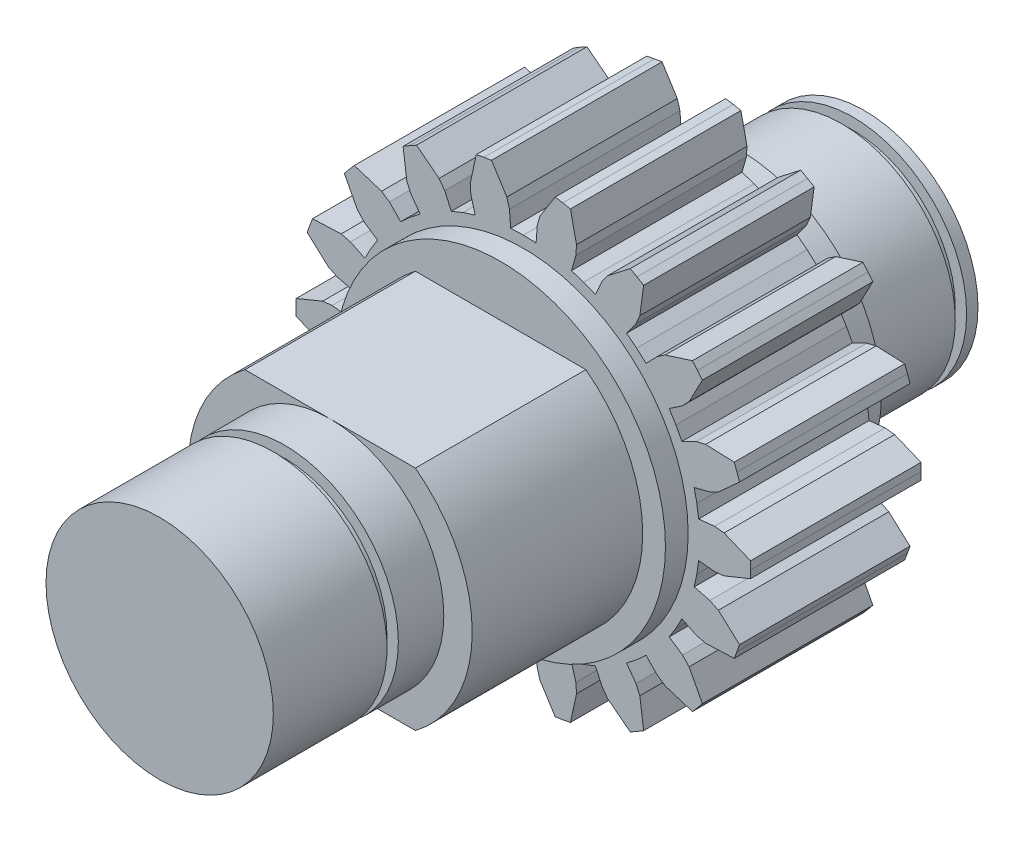
from build123d import *

# Parameters (mm, degrees)
GEAR_C_18T_INVOLUTE_DEPTH     = 15
SKETCH2_R                     = 12.5
LEFT_COLLAR_D25X4_DEPTH       = 4
SKETCH3_R                     = 10
LEFT_SHAFT_D20X15_DEPTH       = 15
SKETCH4_R                     = 14.5
RIGHT_SHOULDER_D29X2_DEPTH    = 2
RIGHT_GEARB_SEAT_D25X15_START = 15
SKETCH5_R                     = 12.5
RIGHT_GEARB_SEAT_D25X15_DEPTH = 15
RIGHT_STUB_D20X15_START       = 15
SKETCH6_R                     = 10
RIGHT_STUB_D20X15_DEPTH       = 15
SKETCH7_W                     = 28
SKETCH7_H                     = 4
DOUBLE_FLAT_CUT_20MM_DEPTH    = 15
SKETCH8_W                     = 1
SKETCH8_H                     = 2
SKETCH9_W                     = 1
SKETCH9_H                     = 2


with BuildPart() as part:
    # Sketch1 → Gear_C_18T_Involute (new body)
    with BuildSketch(Plane.XY):
        Polygon((15.419169018, -1.580894305), (16.826259884, -1.725160312), (17.660768385, -1.634521308), (19.988384487, -0.681531814), (20, 0), (19.988384487, 0.681531814), (17.660768385, 1.634521308), (16.826259884, 1.725160312), (15.419169018, 1.580894305), (15.264520172, 2.691546754), (15.029977041, 3.788111684), (16.401551826, 4.133799402), (17.154732941, 4.504390922), (19.016035012, 6.19599971), (18.793852416, 6.840402867), (18.549839795, 7.476860544), (16.036654516, 7.576286146), (15.221472671, 7.376040232), (13.948581648, 6.75922111), (13.423393759, 7.75), (12.827948015, 8.700215498), (13.998574556, 9.4941619), (14.579583527, 10.10000713), (15.750071069, 12.326202226), (15.320888862, 12.855752194), (14.873910657, 13.370369545), (12.478283437, 12.604239061), (11.780751209, 12.137260841), (10.795589472, 11.122286094), (9.96320795, 11.873688868), (9.078679138, 12.562944922), (9.907162598, 13.709388354), (10.245921168, 14.477413417), (10.584416108, 16.969682839), (10, 17.320508076), (9.403968379, 17.651214653), (7.414847216, 16.111934726), (6.919097286, 15.434548666), (6.34048988, 14.143839227), (5.301312222, 14.565235622), (4.23438757, 14.910397778), (4.620800616, 16.271060244), (4.676449503, 17.108629983), (4.142124355, 19.566369255), (3.472963553, 19.69615506), (2.799768726, 19.80306277), (1.457070989, 17.676293276), (1.222898115, 16.870202132), (1.120633632, 15.459436609), (0, 15.5), (-1.120633632, 15.459436609), (-1.222898115, 16.870202132), (-1.457070989, 17.676293276), (-2.799768726, 19.80306277), (-3.472963553, 19.69615506), (-4.142124355, 19.566369255), (-4.676449503, 17.108629983), (-4.620800616, 16.271060244), (-4.23438757, 14.910397778), (-5.301312222, 14.565235622), (-6.34048988, 14.143839227), (-6.919097286, 15.434548666), (-7.414847216, 16.111934726), (-9.403968379, 17.651214653), (-10, 17.320508076), (-10.584416108, 16.969682839), (-10.245921168, 14.477413417), (-9.907162598, 13.709388354), (-9.078679138, 12.562944922), (-9.96320795, 11.873688868), (-10.795589472, 11.122286094), (-11.780751209, 12.137260841), (-12.478283437, 12.604239061), (-14.873910657, 13.370369545), (-15.320888862, 12.855752194), (-15.750071069, 12.326202226), (-14.579583527, 10.10000713), (-13.998574556, 9.4941619), (-12.827948015, 8.700215498), (-13.423393759, 7.75), (-13.948581648, 6.75922111), (-15.221472671, 7.376040232), (-16.036654516, 7.576286146), (-18.549839795, 7.476860544), (-18.793852416, 6.840402867), (-19.016035012, 6.19599971), (-17.154732941, 4.504390922), (-16.401551826, 4.133799402), (-15.029977041, 3.788111684), (-15.264520172, 2.691546754), (-15.419169018, 1.580894305), (-16.826259884, 1.725160312), (-17.660768385, 1.634521308), (-19.988384487, 0.681531814), (-20, 0), (-19.988384487, -0.681531814), (-17.660768385, -1.634521308), (-16.826259884, -1.725160312), (-15.419169018, -1.580894305), (-15.264520172, -2.691546754), (-15.029977041, -3.788111684), (-16.401551826, -4.133799402), (-17.154732941, -4.504390922), (-19.016035012, -6.19599971), (-18.793852416, -6.840402867), (-18.549839795, -7.476860544), (-16.036654516, -7.576286146), (-15.221472671, -7.376040232), (-13.948581648, -6.75922111), (-13.423393759, -7.75), (-12.827948015, -8.700215498), (-13.998574556, -9.4941619), (-14.579583527, -10.10000713), (-15.750071069, -12.326202226), (-15.320888862, -12.855752194), (-14.873910657, -13.370369545), (-12.478283437, -12.604239061), (-11.780751209, -12.137260841), (-10.795589472, -11.122286094), (-9.96320795, -11.873688868), (-9.078679138, -12.562944922), (-9.907162598, -13.709388354), (-10.245921168, -14.477413417), (-10.584416108, -16.969682839), (-10, -17.320508076), (-9.403968379, -17.651214653), (-7.414847216, -16.111934726), (-6.919097286, -15.434548666), (-6.34048988, -14.143839227), (-5.301312222, -14.565235622), (-4.23438757, -14.910397778), (-4.620800616, -16.271060244), (-4.676449503, -17.108629983), (-4.142124355, -19.566369255), (-3.472963553, -19.69615506), (-2.799768726, -19.80306277), (-1.457070989, -17.676293276), (-1.222898115, -16.870202132), (-1.120633632, -15.459436609), (0, -15.5), (1.120633632, -15.459436609), (1.222898115, -16.870202132), (1.457070989, -17.676293276), (2.799768726, -19.80306277), (3.472963553, -19.69615506), (4.142124355, -19.566369255), (4.676449503, -17.108629983), (4.620800616, -16.271060244), (4.23438757, -14.910397778), (5.301312222, -14.565235622), (6.34048988, -14.143839227), (6.919097286, -15.434548666), (7.414847216, -16.111934726), (9.403968379, -17.651214653), (10, -17.320508076), (10.584416108, -16.969682839), (10.245921168, -14.477413417), (9.907162598, -13.709388354), (9.078679138, -12.562944922), (9.96320795, -11.873688868), (10.795589472, -11.122286094), (11.780751209, -12.137260841), (12.478283437, -12.604239061), (14.873910657, -13.370369545), (15.320888862, -12.855752194), (15.750071069, -12.326202226), (14.579583527, -10.10000713), (13.998574556, -9.4941619), (12.827948015, -8.700215498), (13.423393759, -7.75), (13.948581648, -6.75922111), (15.221472671, -7.376040232), (16.036654516, -7.576286146), (18.549839795, -7.476860544), (18.793852416, -6.840402867), (19.016035012, -6.19599971), (17.154732941, -4.504390922), (16.401551826, -4.133799402), (15.029977041, -3.788111684), (15.264520172, -2.691546754), align=None)
    extrude(amount=GEAR_C_18T_INVOLUTE_DEPTH)

    # Sketch2 → Left_Collar_D25x4 (add)
    with BuildSketch(Plane.XY):
        Circle(SKETCH2_R)
    extrude(amount=-LEFT_COLLAR_D25X4_DEPTH)

    # Sketch3 → Left_Shaft_D20x15 (add)
    with BuildSketch(Plane.XY):
        Circle(SKETCH3_R)
    extrude(amount=-LEFT_SHAFT_D20X15_DEPTH)

    # Sketch4 → Right_Shoulder_D29x2 (add)
    with BuildSketch(Plane.XY.offset(15)):
        Circle(SKETCH4_R)
    extrude(amount=RIGHT_SHOULDER_D29X2_DEPTH)

    # Sketch5 → Right_GearB_Seat_D25x15 (add)
    with BuildSketch(Plane.XY.offset(17).offset(RIGHT_GEARB_SEAT_D25X15_START)):
        Circle(SKETCH5_R)
    extrude(amount=-RIGHT_GEARB_SEAT_D25X15_DEPTH)

    # Sketch6 → Right_Stub_D20x15 (add)
    with BuildSketch(Plane.XY.offset(32).offset(RIGHT_STUB_D20X15_START)):
        Circle(SKETCH6_R)
    extrude(amount=-RIGHT_STUB_D20X15_DEPTH)

    # Sketch7 → Double_Flat_Cut_20mm (cut)
    with BuildSketch(Plane.XY.offset(17)):
        with Locations((0, 12)):
            Rectangle(SKETCH7_W, SKETCH7_H)
        with Locations((0, -12)):
            Rectangle(SKETCH7_W, SKETCH7_H)
    extrude(amount=DOUBLE_FLAT_CUT_20MM_DEPTH, mode=Mode.SUBTRACT)

    # Sketch8 → Left_SnapRing_Groove_D18 (revolve, cut)
    with BuildSketch(Plane(origin=(0, 0, 0), x_dir=(0, 0, -1), z_dir=(1, 0, 0)), mode=Mode.PRIVATE) as left_snapring_groove_d18_sk:
        with Locations((13.5, 10)):
            Rectangle(SKETCH8_W, SKETCH8_H)
    revolve(left_snapring_groove_d18_sk.sketch.rotate(Axis((0, 0, 50), (0, 0, -1)), 90), axis=Axis((0, 0, 50), (0, 0, -1)), mode=Mode.SUBTRACT)

    # Sketch9 → Right_SnapRing_Groove_D18 (revolve, cut)
    with BuildSketch(Plane(origin=(0, 0, 0), x_dir=(0, 0, -1), z_dir=(1, 0, 0)), mode=Mode.PRIVATE) as right_snapring_groove_d18_sk:
        with Locations((-36.5, 10)):
            Rectangle(SKETCH9_W, SKETCH9_H)
    revolve(right_snapring_groove_d18_sk.sketch.rotate(Axis((0, 0, 50), (0, 0, -1)), 180), axis=Axis((0, 0, 50), (0, 0, -1)), mode=Mode.SUBTRACT)


solid = part.part
